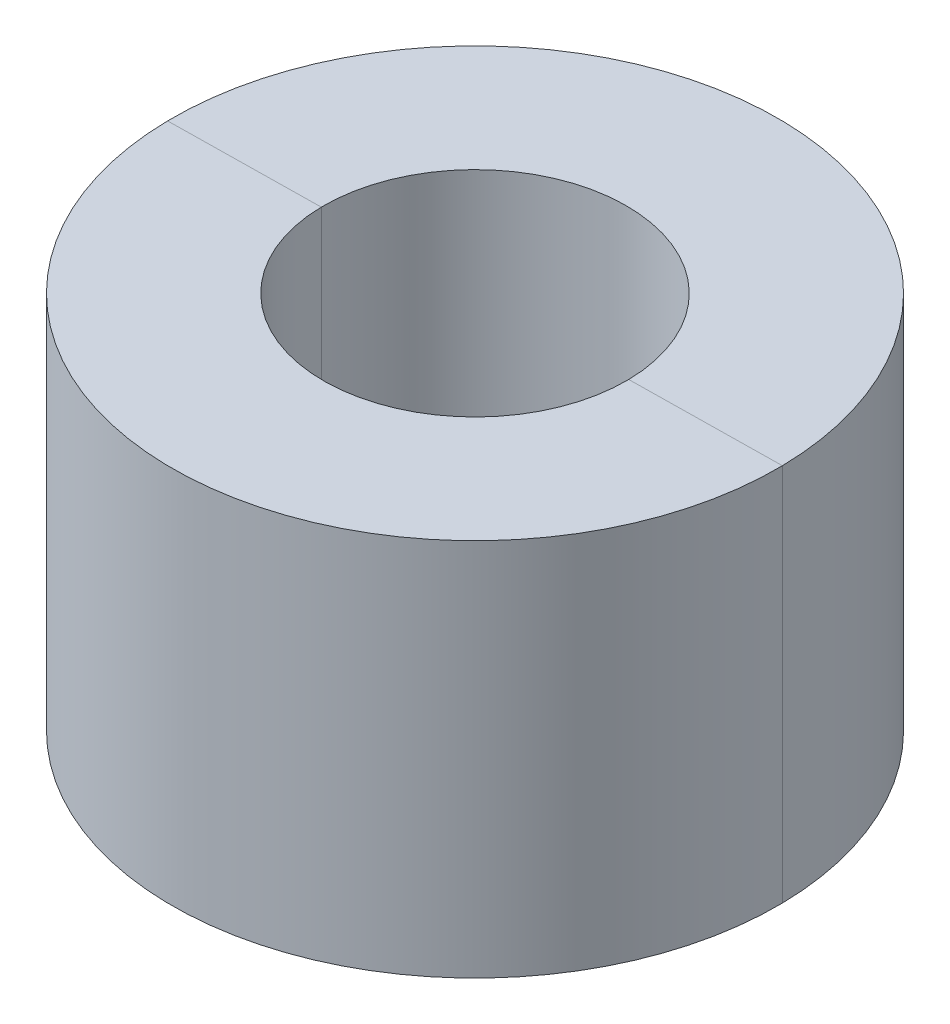
from build123d import *

# Parameters (mm, degrees)
SKETCH1_R              = 20
SKETCH1_R_2            = 10
EXTRUDE_THIN1_DEPTH    = 25
SPLIT1_SURFACE_1_BACK  = 62.847
SPLIT1_SURFACE_1_DEPTH = 125.694
SPLIT1_SURFACE_2_BACK  = 62.847
SPLIT1_SURFACE_2_DEPTH = 125.694


with BuildPart() as part:
    # Sketch1 → Extrude-Thin1 (new body)
    with BuildSketch(Plane(origin=(0, 0, 0), x_dir=(1, 0, 0), z_dir=(0, 1, 0))):
        Circle(SKETCH1_R)
        Circle(SKETCH1_R_2, mode=Mode.SUBTRACT)
    extrude(amount=EXTRUDE_THIN1_DEPTH)


with BuildPart() as body_2:
    # Split1: the piece behind the surface
    add(part.part)
    # Split1 surface: a surface, the sketch's curves swept straight by 125.694 mm
    with BuildLine(Plane(origin=(0, 25, 0), x_dir=(1, 0, 0), z_dir=(0, 1, 0)).offset(-SPLIT1_SURFACE_1_BACK), mode=Mode.PRIVATE) as split1_surface_1_path:
        Line((-26.512584697, -0.386394172), (28.829591237, 0.420162204))
    split1_surface_1 = Shell.extrude(split1_surface_1_path.wire(), (0 * SPLIT1_SURFACE_1_DEPTH, 1 * SPLIT1_SURFACE_1_DEPTH, 0 * SPLIT1_SURFACE_1_DEPTH))
    split(bisect_by=split1_surface_1, keep=Keep.BOTTOM)


with BuildPart() as part_1:
    add(part.part)

    # Split1: split by a surface, the side it looks to stays
    # Split1 surface: a surface, the sketch's curves swept straight by 125.694 mm
    with BuildLine(Plane(origin=(0, 25, 0), x_dir=(1, 0, 0), z_dir=(0, 1, 0)).offset(-SPLIT1_SURFACE_2_BACK), mode=Mode.PRIVATE) as split1_surface_2_path:
        Line((-26.512584697, -0.386394172), (28.829591237, 0.420162204))
    split1_surface_2 = Shell.extrude(split1_surface_2_path.wire(), (0 * SPLIT1_SURFACE_2_DEPTH, 1 * SPLIT1_SURFACE_2_DEPTH, 0 * SPLIT1_SURFACE_2_DEPTH))
    split(bisect_by=split1_surface_2, keep=Keep.TOP)


solid = Compound([body_2.part, part_1.part])
